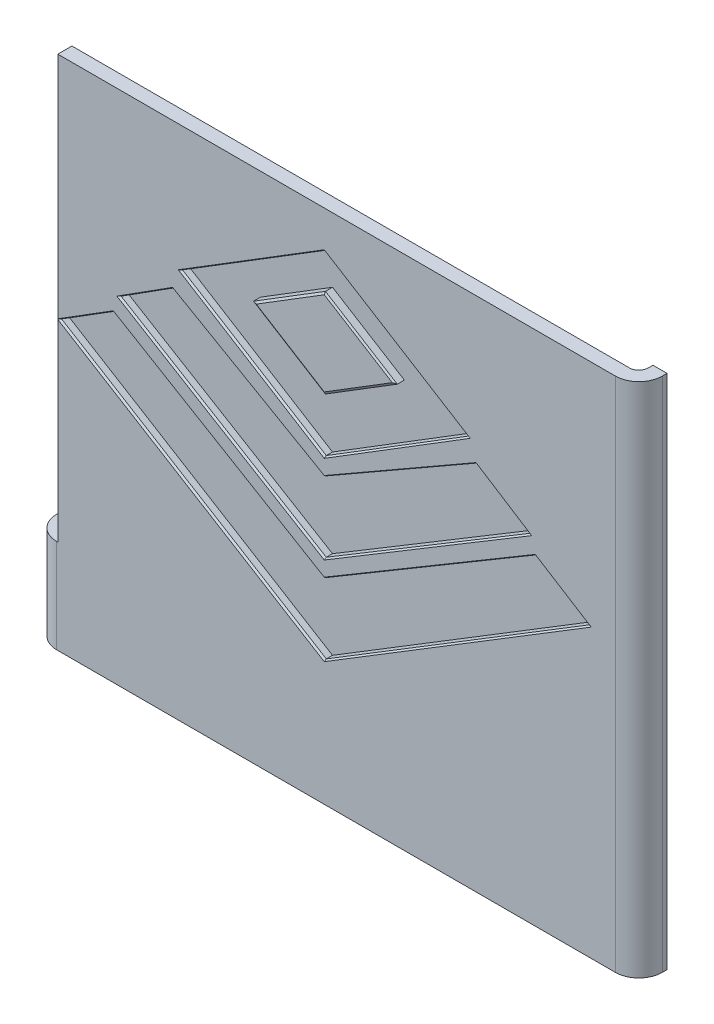
from build123d import *
from OCP.BRepFilletAPI import BRepFilletAPI_MakeChamfer

# Parameters (mm, degrees)
SKETCH1_W           = 129
SKETCH1_H           = 110
BOSS_EXTRUDE1_DEPTH = 3
SKETCH8_W           = 3
SKETCH8_H           = 110
BOSS_EXTRUDE5_DEPTH = 3
FILLET4_R           = 2
FILLET5_R           = 5
SKETCH9_W           = 1
SKETCH9_H           = 110
BOSS_EXTRUDE6_DEPTH = 2.5
BOSS_EXTRUDE7_DEPTH = 110
CUT_EXTRUDE3_DEPTH  = 1.75
CHAMFER3_SIZE       = 0.25
CHAMFER3_SIZE2      = 0.433012702
SKETCH14_W          = 3.26
SKETCH14_H          = 110
BOSS_EXTRUDE8_DEPTH = 3.5
FILLET6_R           = 2
FILLET7_R           = 5
CUT_EXTRUDE4_START  = -6.5
SKETCH17_W          = 5.25
SKETCH17_H          = 90
CUT_EXTRUDE4_DEPTH  = 6.5
SKETCH18_W          = 3
SKETCH18_H          = 3.302013378
CUT_EXTRUDE5_DEPTH  = 110


with BuildPart() as part:
    # Sketch1 → Boss-Extrude1 (new body)
    with BuildSketch(Plane.XY):
        with Locations((-5, 1)):
            Rectangle(SKETCH1_W, SKETCH1_H)
    extrude(amount=BOSS_EXTRUDE1_DEPTH)

    # Sketch8 → Boss-Extrude5 (add)
    with BuildSketch(Plane(origin=(0, 0, 0), x_dir=(-1, 0, 0), z_dir=(0, 0, -1))):
        with Locations((-58, 1)):
            Rectangle(SKETCH8_W, SKETCH8_H)
    extrude(amount=BOSS_EXTRUDE5_DEPTH)

    # Fillet4
    fillet4_edges = [part.edges().sort_by_distance(p)[0] for p in [
        (56.5, 1, 0),
    ]]
    fillet(fillet4_edges, radius=FILLET4_R)

    # Fillet5
    fillet5_edges = [part.edges().sort_by_distance(p)[0] for p in [
        (59.5, 1, 3),
    ]]
    fillet(fillet5_edges, radius=FILLET5_R)

    # Sketch9 → Boss-Extrude6 (add)
    with BuildSketch(Plane(origin=(0, 0, -3), x_dir=(-1, 0, 0), z_dir=(0, 0, -1))):
        with Locations((-58, 1)):
            Rectangle(SKETCH9_W, SKETCH9_H)
    extrude(amount=BOSS_EXTRUDE6_DEPTH)

    # Sketch10 → Boss-Extrude7 (add, through all)
    with BuildSketch(Plane(origin=(0, 56, 0), x_dir=(1, 0, 0), z_dir=(0, 1, 0))):
        Polygon((57.5, 5.5), (57, 3), (57.5, 3), align=None)
    extrude(amount=-BOSS_EXTRUDE7_DEPTH)

    # Sketch13 → Cut-Extrude3 (cut)
    # profile 1 of 3: a face of its own
    with BuildSketch(Plane.XY.offset(3)):
        Polygon((-7.5, 48), (-38.1126801, 29.056298749), (-7.5, 10.112597497), (23.1126801, 29.056298749), align=None)
        Polygon((-7.5, 40.5), (-22.80634005, 31.028149374), (-7.5, 21.556298749), (7.80634005, 31.028149374), align=None, mode=Mode.SUBTRACT)
    # profile 2 of 3: a face of its own
    with BuildSketch(Plane.XY.offset(3)):
        Polygon((-39.806973372, 24.905034542), (-51.197681844, 17.659224685), (-7.5, -8.637402503), (36.197681844, 17.659224685), (24.806973372, 24.905034542), (-7.5, 6.362597497), align=None)
    # profile 3 of 3: a face of its own
    with BuildSketch(Plane.XY.offset(3)):
        Polygon((-52.431392449, 14.281539595), (-63.876517147, 7.121992079), (-7.5, -27.387402503), (48.876517147, 7.121992079), (37.431392449, 14.281539595), (-7.5, -12.387402503), align=None)
    extrude(amount=-CUT_EXTRUDE3_DEPTH, mode=Mode.SUBTRACT)

    # Chamfer3: one chamfer whose edges measure the first distance from different faces: ONE call of the kernel's chamfer builder (chamfer() names one face for all edges)
    chamfer3_edges_1 = [part.edges().sort_by_distance(p)[0] for p in [
        (-23.653486686, 15.63381602, 3),
        (-45.502327608, 21.282129613, 3),
        (-29.348840922, 4.510911091, 3),
        (14.348840922, 4.510911091, 3),
        (30.502327608, 21.282129613, 3),
        (8.653486686, 15.63381602, 3),
        (-29.965696224, 0.947068546, 3),
        (-58.153954798, 10.701765837, 3),
        (-35.688258573, -10.132705212, 3),
        (20.688258573, -10.132705212, 3),
        (43.153954798, 10.701765837, 3),
        (14.965696224, 0.947068546, 3),
        (7.80634005, 38.528149374, 3),
        (-22.80634005, 38.528149374, 3),
        (-22.80634005, 19.584448123, 3),
        (7.80634005, 19.584448123, 3),
    ]]
    chamfer3_side_1 = [part.faces().sort_by_distance(p)[0] for p in [
        (-7.5, 54.34241139, 3),
    ]]
    chamfer3_edges_2 = [part.edges().sort_by_distance(p)[0] for p in [
        (0.153170025, 35.764074687, 3),
    ]]
    chamfer3_side_2 = [part.faces().sort_by_distance(p)[0] for p in [
        (0.153170025, 35.764074687, 2.125),
    ]]
    chamfer3_edges_3 = [part.edges().sort_by_distance(p)[0] for p in [
        (0.153170025, 26.292224061, 3),
    ]]
    chamfer3_side_3 = [part.faces().sort_by_distance(p)[0] for p in [
        (0.153170025, 26.292224061, 2.125),
    ]]
    chamfer3_edges_4 = [part.edges().sort_by_distance(p)[0] for p in [
        (-15.153170025, 26.292224061, 3),
    ]]
    chamfer3_side_4 = [part.faces().sort_by_distance(p)[0] for p in [
        (-15.153170025, 26.292224061, 2.125),
    ]]
    chamfer3_edges_5 = [part.edges().sort_by_distance(p)[0] for p in [
        (-15.153170025, 35.764074687, 3),
    ]]
    chamfer3_side_5 = [part.faces().sort_by_distance(p)[0] for p in [
        (-15.153170025, 35.764074687, 2.125),
    ]]
    chamfer3 = BRepFilletAPI_MakeChamfer(part.part.solid().wrapped)
    for e in chamfer3_edges_1:
        chamfer3.Add(CHAMFER3_SIZE, CHAMFER3_SIZE2, e.wrapped, chamfer3_side_1[0].wrapped)  # the first distance lies on this face
    for e in chamfer3_edges_2:
        chamfer3.Add(CHAMFER3_SIZE, CHAMFER3_SIZE2, e.wrapped, chamfer3_side_2[0].wrapped)  # the first distance lies on this face
    for e in chamfer3_edges_3:
        chamfer3.Add(CHAMFER3_SIZE, CHAMFER3_SIZE2, e.wrapped, chamfer3_side_3[0].wrapped)  # the first distance lies on this face
    for e in chamfer3_edges_4:
        chamfer3.Add(CHAMFER3_SIZE, CHAMFER3_SIZE2, e.wrapped, chamfer3_side_4[0].wrapped)  # the first distance lies on this face
    for e in chamfer3_edges_5:
        chamfer3.Add(CHAMFER3_SIZE, CHAMFER3_SIZE2, e.wrapped, chamfer3_side_5[0].wrapped)  # the first distance lies on this face
    add(Compound.cast(chamfer3.Shape()), mode=Mode.REPLACE)

    # Sketch14 → Boss-Extrude8 (add)
    with BuildSketch(Plane(origin=(0, 0, 0), x_dir=(-1, 0, 0), z_dir=(0, 0, -1))):
        with Locations((67.87, 1)):
            Rectangle(SKETCH14_W, SKETCH14_H)
    extrude(amount=BOSS_EXTRUDE8_DEPTH)

    # Fillet6
    fillet6_edges = [part.edges().sort_by_distance(p)[0] for p in [
        (-66.24, 1, 0),
    ]]
    fillet(fillet6_edges, radius=FILLET6_R)

    # Fillet7
    fillet7_edges = [part.edges().sort_by_distance(p)[0] for p in [
        (-69.5, 1, 3),
    ]]
    fillet(fillet7_edges, radius=FILLET7_R)

    # Sketch17 → Cut-Extrude4 (cut)
    with BuildSketch(Plane(origin=(0, 0, -3.5), x_dir=(-1, 0, 0), z_dir=(0, 0, -1)).offset(CUT_EXTRUDE4_START)):
        with Locations((66.875, 11)):
            Rectangle(SKETCH17_W, SKETCH17_H)
    extrude(amount=CUT_EXTRUDE4_DEPTH, mode=Mode.SUBTRACT)

    # Sketch18 → Cut-Extrude5 (cut)
    with BuildSketch(Plane(origin=(0, 56, 0), x_dir=(1, 0, 0), z_dir=(0, 1, 0))):
        with Locations((58, 4.651006689)):
            Rectangle(SKETCH18_W, SKETCH18_H)
    extrude(amount=-CUT_EXTRUDE5_DEPTH, mode=Mode.SUBTRACT)


solid = part.part
